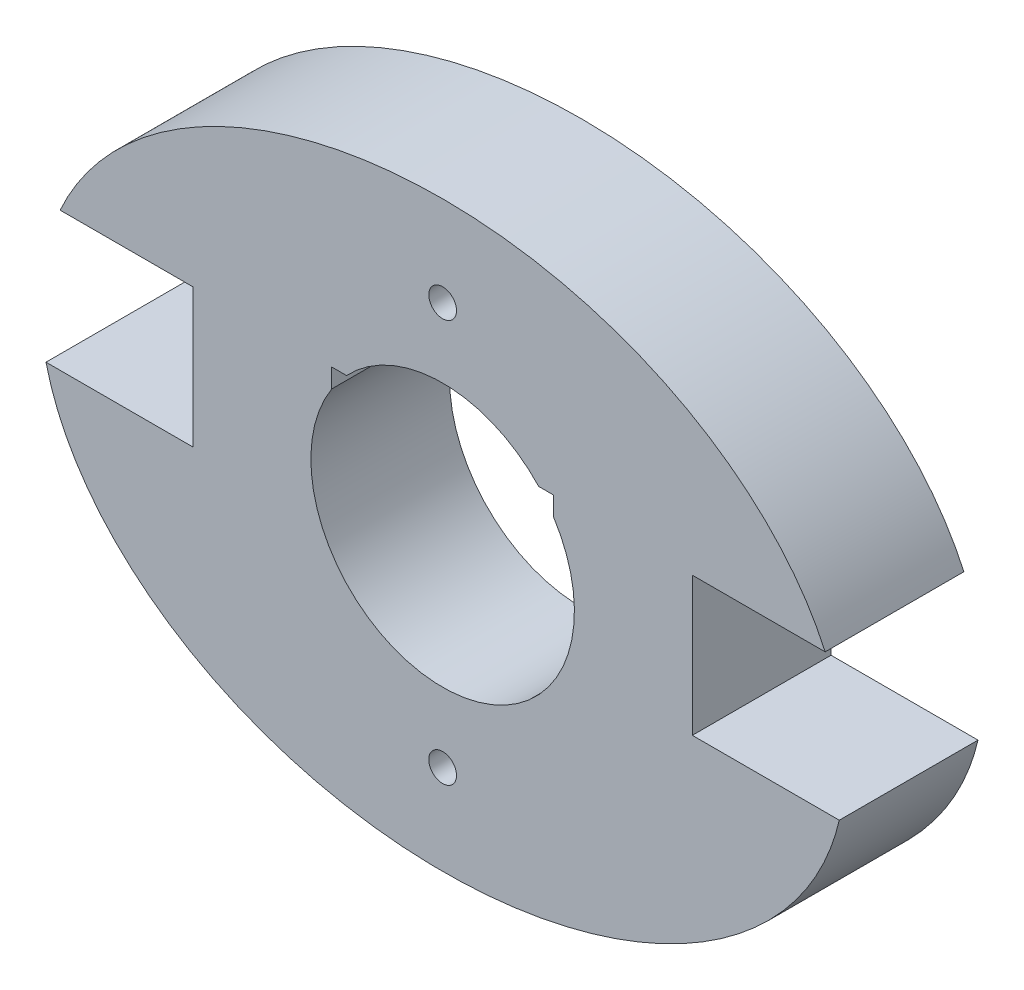
from build123d import *

# Parameters (mm, degrees)
ESQUISSE1_R             = 0.5
ESQUISSE1_R_2           = 4.75
BOSS_EXTRU_1_DEPTH      = 5
ESQUISSE2_W             = 8
ESQUISSE2_H             = 5
ENL_V_MAT_EXTRU_1_DEPTH = 5


with BuildPart() as part:
    # Esquisse1 → Boss.-Extru.1 (new body)
    with BuildSketch(Plane.XY):
        with BuildLine():
            Line((-13.787929545, 3.25), (-9, 3.25))
            Line((-9, 3.25), (-9, -1.75))
            Line((-9, -1.75), (-14.297192809, -1.75))
            add(Edge.make_bspline(
                [(-14.297192809, -1.75), (-12.254736694, -10.5), (0, -10.5), (12.254736694, -10.5), (14.297192809, -1.75)],
                knots=[3.309040733, 3.309040733, 3.309040733, 4.71238898, 4.71238898, 6.115737228, 6.115737228, 6.115737228], degree=2, weights=[1, 0.763762616, 1, 0.763762616, 1]))
            Line((14.297192809, -1.75), (9, -1.75))
            Line((9, -1.75), (9, 3.25))
            Line((9, 3.25), (13.787929545, 3.25))
            add(Edge.make_bspline(
                [(13.787929545, 3.25), (0, 33.923076923), (-13.787929545, 3.25)],
                knots=[0.314692209, 0.314692209, 0.314692209, 2.826900445, 2.826900445, 2.826900445], degree=2, weights=[1, 0.30952381, 1]))
        make_face()
        with Locations((0, 7.2545)):
            Circle(ESQUISSE1_R, mode=Mode.SUBTRACT)
        with Locations((0, -7.2545)):
            Circle(ESQUISSE1_R, mode=Mode.SUBTRACT)
        Circle(ESQUISSE1_R_2, mode=Mode.SUBTRACT)
    extrude(amount=BOSS_EXTRU_1_DEPTH)

    # Esquisse2 → Enlèv. mat.-Extru.1 (cut)
    with BuildSketch(Plane(origin=(0, 0, 0), x_dir=(-1, 0, 0), z_dir=(0, 0, -1))):
        with Locations((0, 0.75)):
            Rectangle(ESQUISSE2_W, ESQUISSE2_H)
    extrude(amount=-ENL_V_MAT_EXTRU_1_DEPTH, mode=Mode.SUBTRACT)


solid = part.part
